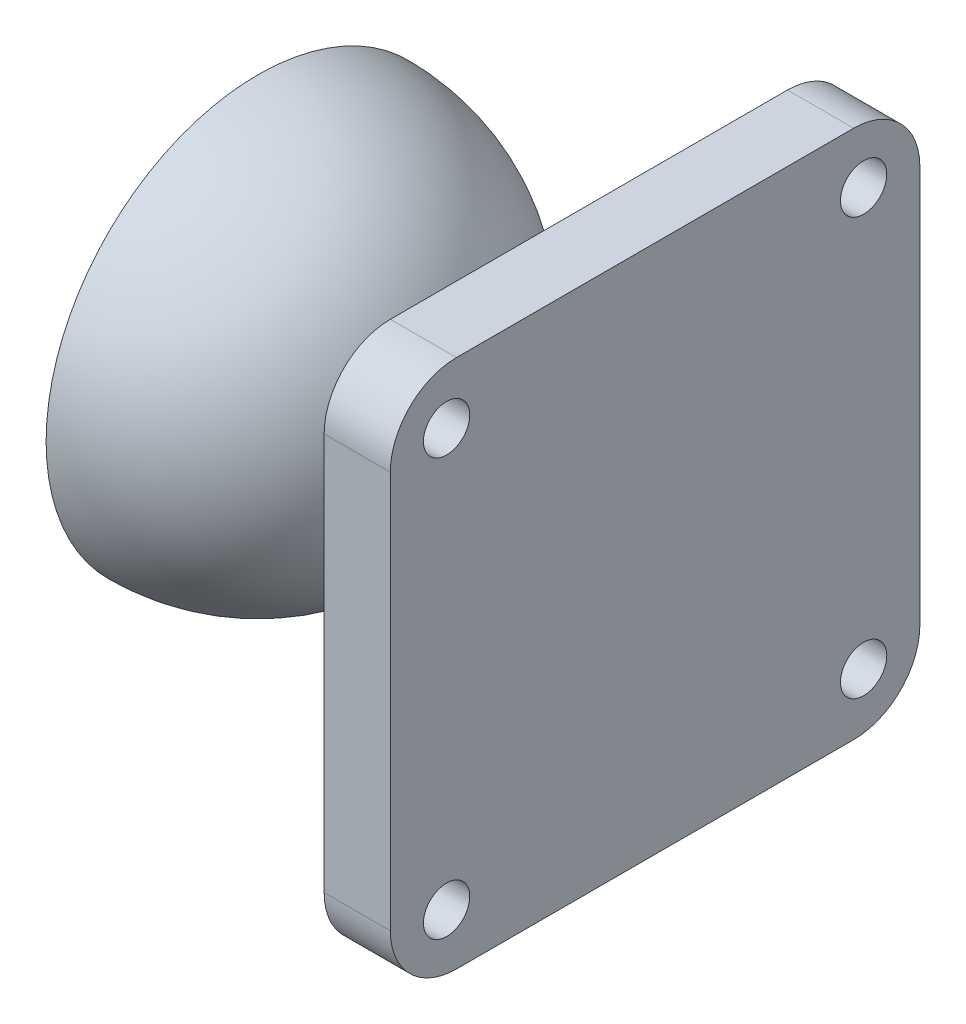
from build123d import *
from build123d.topology import SkipClean

# Parameters (mm, degrees)
SALIENTE_EXTRUIR1_REACH      = 54.713
SALIENTE_EXTRUIR1_END_RADIUS = 16
SALIENTE_EXTRUIR1_START      = -25
CROQUIS2_R                   = 7.5
CROQUIS3_W                   = 40
CROQUIS3_H                   = 40
SALIENTE_EXTRUIR2_DEPTH      = 5
REDONDEO1_R                  = 5
CROQUIS4_R                   = 1.75
CORTAR_EXTRUIR1_DEPTH        = 5


with BuildPart() as part:
    # Croquis1 → Revolución-Lámina1 (revolve)
    with BuildSketch(Plane.XY):
        with BuildLine():
            ThreePointArc((15, 0), (10.606601718, 10.606601718), (0, 15))
            Line((0, 15), (0, 16))
            ThreePointArc((0, 16), (11.313708499, 11.313708499), (16, 0))
            Line((16, 0), (15, 0))
        make_face()
    revolve(axis=Axis((0, 0, 0), (1, 0, 0)))

    # Saliente-Extruir1: up to this sphere (the profile starts outside it)
    with SkipClean():  # the faces are left unmerged after this step: merging them gives an invalid solid
        saliente_extruir1_end = Location((0, 0, 0)) * Sphere(SALIENTE_EXTRUIR1_END_RADIUS, mode=Mode.PRIVATE)
        # Croquis2 → Saliente-Extruir1 (add, up to the surface)
        with BuildSketch(Plane.ZY.offset(SALIENTE_EXTRUIR1_START), mode=Mode.PRIVATE) as saliente_extruir1_sk1:
            with Locations(Location((0, 0, 0), (0, 0, 180))):
                Circle(CROQUIS2_R)
        saliente_extruir1_tool1 = extrude(saliente_extruir1_sk1.sketch, amount=SALIENTE_EXTRUIR1_REACH, mode=Mode.PRIVATE) - saliente_extruir1_end
        add(saliente_extruir1_tool1.solids().sort_by_distance((25, 0, 0))[0])

    # Croquis3 → Saliente-Extruir2 (add)
    with BuildSketch(Plane(origin=(25, 0, 0), x_dir=(0, 0, -1), z_dir=(1, 0, 0))):
        Rectangle(CROQUIS3_W, CROQUIS3_H)
    extrude(amount=SALIENTE_EXTRUIR2_DEPTH)

    # Redondeo1
    redondeo1_edges = [part.edges().sort_by_distance(p)[0] for p in [
        (27.5, -20, -20),
        (27.5, 20, -20),
        (27.5, 20, 20),
        (27.5, -20, 20),
    ]]
    fillet(redondeo1_edges, radius=REDONDEO1_R)

    # Croquis4 → Cortar-Extruir1 (cut)
    with BuildSketch(Plane(origin=(30, 0, 0), x_dir=(0, 0, -1), z_dir=(1, 0, 0))):
        with Locations((-15.75, 15.75)):
            Circle(CROQUIS4_R)
        with Locations(Location((15.75, 15.75, 0), (0, 0, 180))):
            Circle(CROQUIS4_R)
        with Locations((15.75, -15.75)):
            Circle(CROQUIS4_R)
        with Locations(Location((-15.75, -15.75, 0), (0, 0, 180))):
            Circle(CROQUIS4_R)
    extrude(amount=-CORTAR_EXTRUIR1_DEPTH, mode=Mode.SUBTRACT)


solid = part.part
